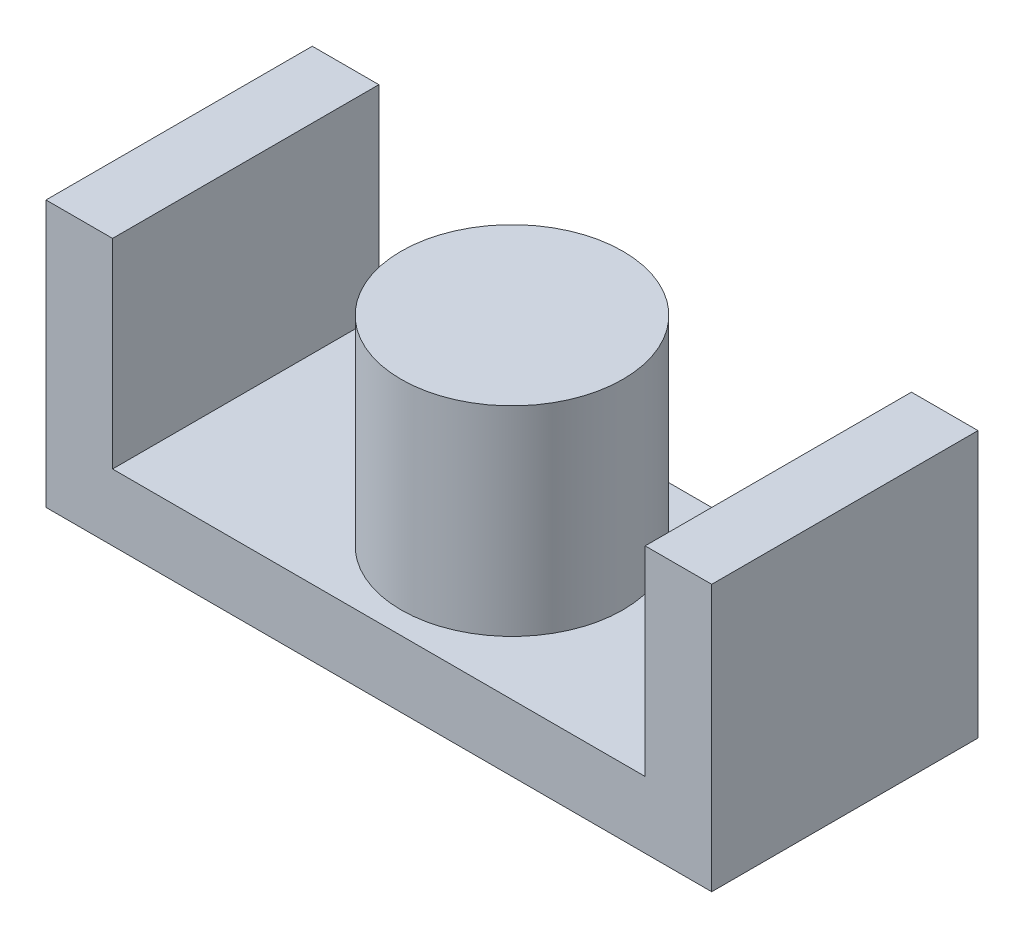
from build123d import *

# Parameters (mm, degrees)
SKETCH1_W           = 19.05
SKETCH1_H           = 7.62
BOSS_EXTRUDE1_DEPTH = 1.905
SKETCH2_R           = 3.175
BOSS_EXTRUDE2_DEPTH = 5.715
SKETCH3_W           = 1.905
SKETCH3_H           = 7.62
BOSS_EXTRUDE3_DEPTH = 5.715


with BuildPart() as part:
    # Sketch1 → Boss-Extrude1 (new body)
    with BuildSketch(Plane(origin=(0, 0, 0), x_dir=(-1, 0, 0), z_dir=(0, 1, 0))):
        with Locations((9.525, 3.81)):
            Rectangle(SKETCH1_W, SKETCH1_H)
    extrude(amount=BOSS_EXTRUDE1_DEPTH)

    # Sketch2 → Boss-Extrude2 (add)
    with BuildSketch(Plane(origin=(0, 1.905, 0), x_dir=(-1, 0, 0), z_dir=(0, 1, 0))):
        with Locations(Location((9.525, 3.81, 0), (0, 0, 90))):
            Circle(SKETCH2_R)
    extrude(amount=BOSS_EXTRUDE2_DEPTH)

    # Sketch3 → Boss-Extrude3 (add)
    with BuildSketch(Plane(origin=(0, 1.905, 0), x_dir=(-1, 0, 0), z_dir=(0, 1, 0))):
        with Locations((0.9525, 3.81)):
            Rectangle(SKETCH3_W, SKETCH3_H)
        with Locations((18.0975, 3.81)):
            Rectangle(SKETCH3_W, SKETCH3_H)
    extrude(amount=BOSS_EXTRUDE3_DEPTH)


solid = part.part
